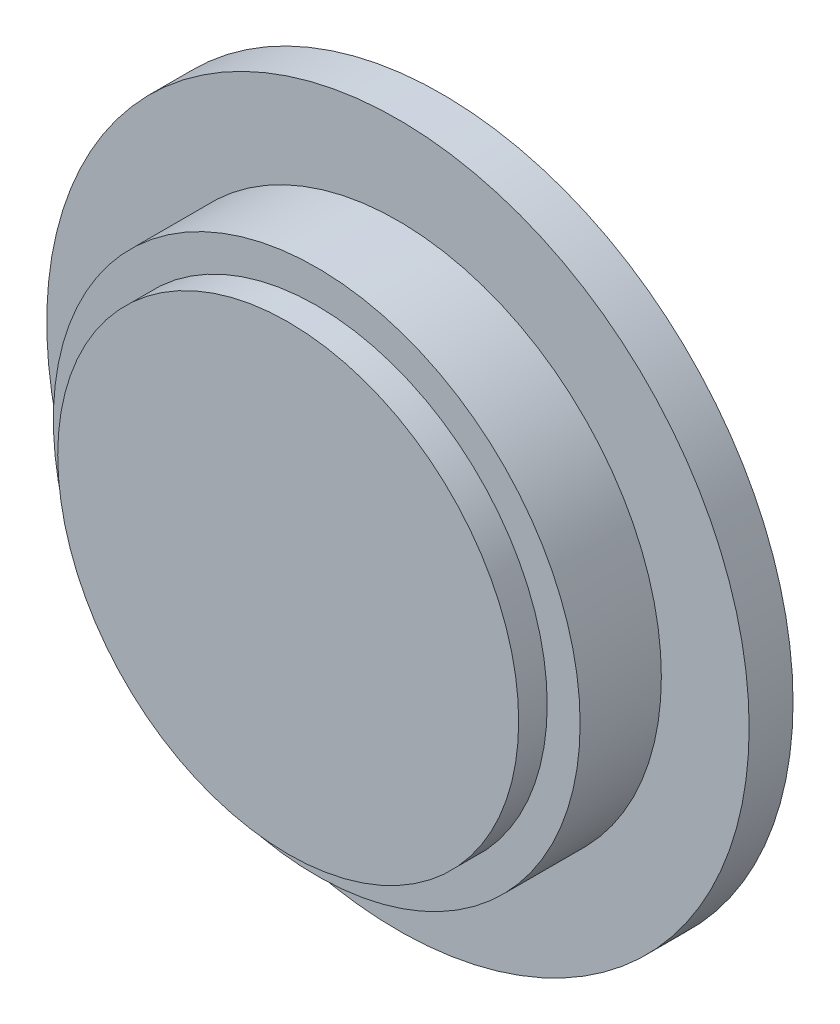
from build123d import *

# Parameters (mm, degrees)
SKETCH5_R           = 160
BOSS_EXTRUDE3_DEPTH = 20
SKETCH6_R           = 120
BOSS_EXTRUDE4_DEPTH = 37
SKETCH7_R           = 88
BOSS_EXTRUDE5_DEPTH = 10
SKETCH12_R          = 105
BOSS_EXTRUDE6_DEPTH = 13


with BuildPart() as part:
    # Sketch5 → Boss-Extrude3 (new body)
    with BuildSketch(Plane.XY):
        Circle(SKETCH5_R)
    extrude(amount=BOSS_EXTRUDE3_DEPTH)

    # Sketch6 → Boss-Extrude4 (add)
    with BuildSketch(Plane.XY.offset(20)):
        Circle(SKETCH6_R)
    extrude(amount=BOSS_EXTRUDE4_DEPTH)

    # Sketch7 → Boss-Extrude5 (add)
    with BuildSketch(Plane(origin=(0, 0, 0), x_dir=(-1, 0, 0), z_dir=(0, 0, -1))):
        Circle(SKETCH7_R)
    extrude(amount=BOSS_EXTRUDE5_DEPTH)

    # Sketch12 → Boss-Extrude6 (add)
    with BuildSketch(Plane.XY.offset(57)):
        with Locations(Location((0, 0, 0), (0, 0, 180))):
            Circle(SKETCH12_R)
    extrude(amount=BOSS_EXTRUDE6_DEPTH)


solid = part.part
